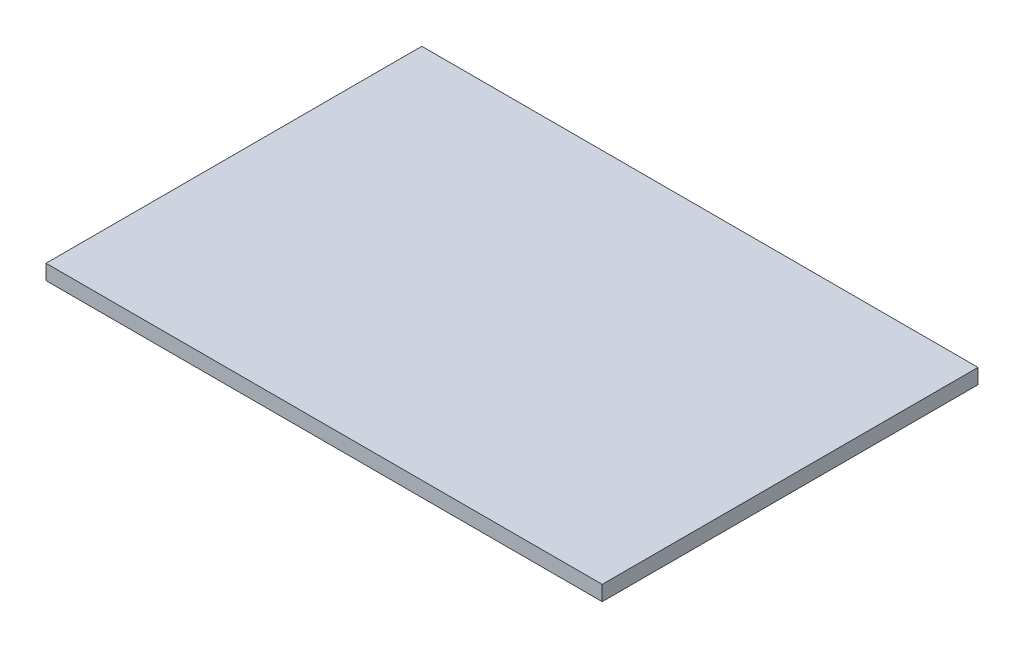
from build123d import *

# Parameters (mm, degrees)
IZIM2_W                     = 370
IZIM2_H                     = 250
Y_KSEKLIK_EKSTR_ZYON1_DEPTH = 10


with BuildPart() as part:
    # Çizim2 → Yükseklik-Ekstrüzyon1 (new body)
    with BuildSketch(Plane(origin=(0, 0, 0), x_dir=(1, 0, 0), z_dir=(0, 1, 0))):
        with Locations((52.926176947, 3.974763407)):
            Rectangle(IZIM2_W, IZIM2_H)
    extrude(amount=Y_KSEKLIK_EKSTR_ZYON1_DEPTH)


solid = part.part
